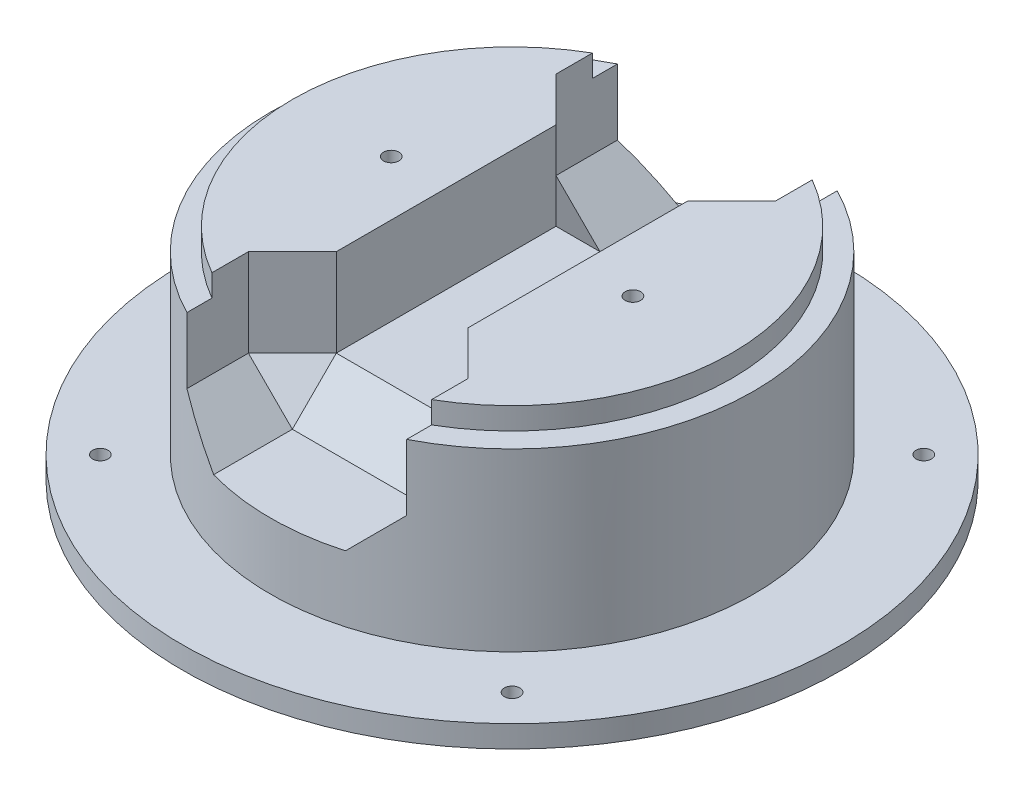
from build123d import *

# Parameters (mm, degrees)
SKETCH1_R                           = 55
BOSS_EXTRUDE1_DEPTH                 = 40
SKETCH2_R                           = 75
BOSS_EXTRUDE2_DEPTH                 = 5
SKETCH6_R                           = 50
BOSS_EXTRUDE3_DEPTH                 = 5
F_3_5_3_5_DIAMETER_HOLE1_D          = 3.5
F_3_5_3_5_DIAMETER_HOLE1_DEPTH      = 10
F_3_5_3_5_DIAMETER_HOLE1_TIP        = 1.051506083
SKETCH7_W                           = 50
SKETCH7_H                           = 60
CUT_EXTRUDE1_DEPTH                  = 30
CHAMFER1_SIZE                       = 10
SKETCH8_W                           = 30
SKETCH8_H                           = 50
CUT_EXTRUDE2_DEPTH                  = 20
F_3_5_3_5_DIAMETER_HOLE2_AT_2_COUNT = 2
F_3_5_3_5_DIAMETER_HOLE2_AT_2_PITCH = 66.25
F_3_5_3_5_DIAMETER_HOLE2_AT_3_COUNT = 2
F_3_5_3_5_DIAMETER_HOLE2_AT_3_PITCH = 66.25
F_3_5_3_5_DIAMETER_HOLE2_AT_4_COUNT = 2
F_3_5_3_5_DIAMETER_HOLE2_AT_4_PITCH = 66.25
F_3_5_3_5_DIAMETER_HOLE2_AT_5_COUNT = 2
F_3_5_3_5_DIAMETER_HOLE2_AT_5_PITCH = 66.25


with BuildPart() as part:
    # Sketch1 → Boss-Extrude1 (new body)
    with BuildSketch(Plane(origin=(0, 0, 0), x_dir=(1, 0, 0), z_dir=(0, 1, 0))):
        with Locations(Location((0, 0, 0), (0, 0, 270))):
            Circle(SKETCH1_R)
    extrude(amount=BOSS_EXTRUDE1_DEPTH)

    # Sketch2 → Boss-Extrude2 (add)
    with BuildSketch(Plane.XZ):
        with Locations(Location((0, 0, 0), (0, 0, 270))):
            Circle(SKETCH2_R)
    extrude(amount=BOSS_EXTRUDE2_DEPTH)

    # Sketch6 → Boss-Extrude3 (add)
    with BuildSketch(Plane(origin=(0, 40, 0), x_dir=(1, 0, 0), z_dir=(0, 1, 0))):
        with Locations(Location((0, 0, 0), (0, 0, 270))):
            Circle(SKETCH6_R)
    extrude(amount=BOSS_EXTRUDE3_DEPTH)

    # Ø3.5 (3.5) Diameter Hole1
    with Locations(Plane(origin=(-12.746034072, 45, -7.868896946), x_dir=(1, 0, 0), z_dir=(0, 1, 0))):
        with Locations((-14.753965928, -7.868896946), (40.246034072, -7.868896946)):
            Hole(F_3_5_3_5_DIAMETER_HOLE1_D / 2, depth=F_3_5_3_5_DIAMETER_HOLE1_DEPTH)
            with Locations((0, 0, -(F_3_5_3_5_DIAMETER_HOLE1_DEPTH + F_3_5_3_5_DIAMETER_HOLE1_TIP / 2))):  # 118° drill point
                Cone(0, F_3_5_3_5_DIAMETER_HOLE1_D / 2, F_3_5_3_5_DIAMETER_HOLE1_TIP, mode=Mode.SUBTRACT)

    # Sketch7 → Cut-Extrude1 (cut)
    with BuildSketch(Plane(origin=(0, 45, 0), x_dir=(1, 0, 0), z_dir=(0, 1, 0))):
        with Locations((0, 55)):
            Rectangle(SKETCH7_W, SKETCH7_H)
        with Locations((0, -55)):
            Rectangle(SKETCH7_W, SKETCH7_H)
    extrude(amount=-CUT_EXTRUDE1_DEPTH, mode=Mode.SUBTRACT)

    # Chamfer1
    chamfer1_edges = [part.edges().sort_by_distance(p)[0] for p in [
        (25, 15, -36.994897428),
        (-25, 15, -36.994897428),
        (-25, 30, -25),
        (0, 15, -25),
        (25, 30, -25),
        (25, 15, 36.994897428),
        (25, 30, 25),
        (-25, 15, 36.994897428),
        (0, 15, 25),
        (-25, 30, 25),
    ]]
    chamfer(chamfer1_edges, length=CHAMFER1_SIZE)

    # Sketch8 → Cut-Extrude2 (cut)
    with BuildSketch(Plane(origin=(0, 45, 0), x_dir=(1, 0, 0), z_dir=(0, 1, 0))):
        Rectangle(SKETCH8_W, SKETCH8_H)
    extrude(amount=-CUT_EXTRUDE2_DEPTH, mode=Mode.SUBTRACT)

    # Sketch9 → Ø3.5 (3.5) Diameter Hole2 (revolve, cut)
    with BuildSketch(Plane(origin=(0, 0, 0), x_dir=(0, 0, 1), z_dir=(1, 0, 0))):
        Polygon((0, 0), (0, 11.051506083), (1.75, 10), (1.75, 0), align=None)
    f_3_5_3_5_diameter_hole2 = revolve(axis=Axis((0, 6.35, 0), (0, -1, 0)), mode=Mode.SUBTRACT)

    # Ø3.5 (3.5) Diameter Hole2 at 2: Ø3.5 (3.5) Diameter Hole2 ×2
    with Locations(*[Vector(0.7071067811865477, 0, 0.7071067811865475) * (i * F_3_5_3_5_DIAMETER_HOLE2_AT_2_PITCH) for i in range(1, F_3_5_3_5_DIAMETER_HOLE2_AT_2_COUNT)]):
        add(f_3_5_3_5_diameter_hole2, mode=Mode.SUBTRACT)

    # Ø3.5 (3.5) Diameter Hole2 at 3: Ø3.5 (3.5) Diameter Hole2 ×2
    with Locations(*[Vector(-0.7071067811865478, 0, -0.7071067811865474) * (i * F_3_5_3_5_DIAMETER_HOLE2_AT_3_PITCH) for i in range(1, F_3_5_3_5_DIAMETER_HOLE2_AT_3_COUNT)]):
        add(f_3_5_3_5_diameter_hole2, mode=Mode.SUBTRACT)

    # Ø3.5 (3.5) Diameter Hole2 at 4: Ø3.5 (3.5) Diameter Hole2 ×2
    with Locations(*[Vector(-0.7071067811865476, 0, 0.7071067811865476) * (i * F_3_5_3_5_DIAMETER_HOLE2_AT_4_PITCH) for i in range(1, F_3_5_3_5_DIAMETER_HOLE2_AT_4_COUNT)]):
        add(f_3_5_3_5_diameter_hole2, mode=Mode.SUBTRACT)

    # Ø3.5 (3.5) Diameter Hole2 at 5: Ø3.5 (3.5) Diameter Hole2 ×2
    with Locations(*[Vector(0.7071067811865476, 0, -0.7071067811865476) * (i * F_3_5_3_5_DIAMETER_HOLE2_AT_5_PITCH) for i in range(1, F_3_5_3_5_DIAMETER_HOLE2_AT_5_COUNT)]):
        add(f_3_5_3_5_diameter_hole2, mode=Mode.SUBTRACT)


solid = part.part
